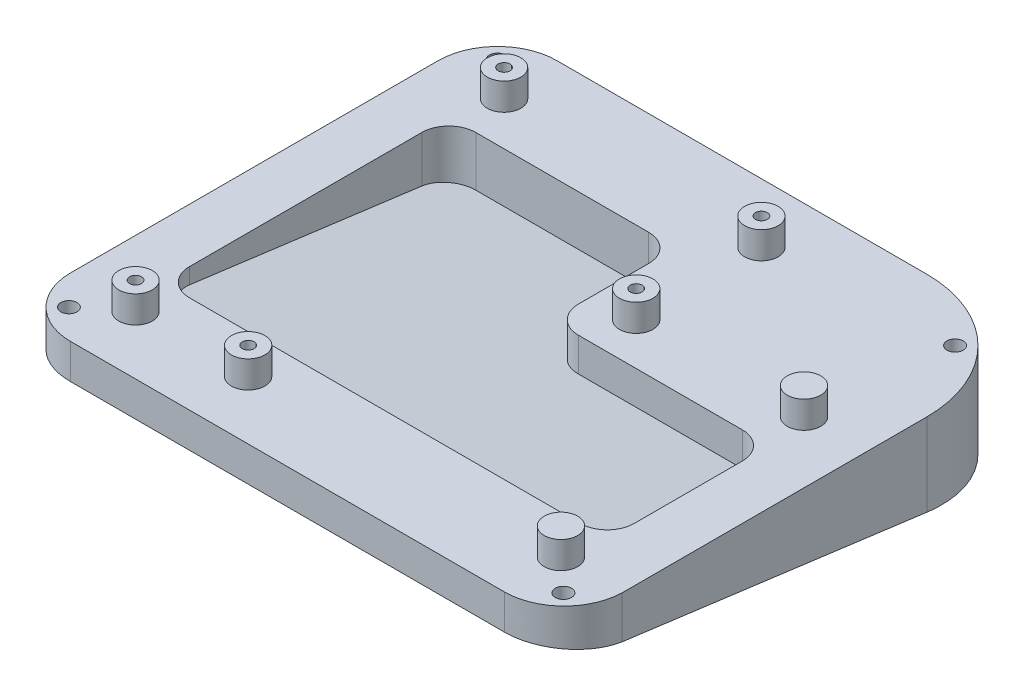
from build123d import *

# Parameters (mm, degrees)
SKETCH1_R                        = 1.1
SKETCH1_R_2                      = 1.5
BOSS_EXTRUDE1_DEPTH              = 3.048
SKETCH2_R                        = 3.1
SKETCH2_R_2                      = 1.1
BOSS_EXTRUDE2_DEPTH              = 5
BOSS_EXTRUDE4_START              = -13.75
SKETCH1_5_R                      = 1.1
SKETCH1_5_R_2                    = 1.5
BOSS_EXTRUDE4_DEPTH              = 13.75
CUT_EXTRUDE1_DEPTH               = 113.753315675
CUT_EXTRUDE2_REACH               = 77.409
CUT_EXTRUDE2_OFFSET_FROM_SURFACE = 5
FILLET1_R                        = 5
BOSS_EXTRUDE6_DEPTH              = 1.5


with BuildPart() as part:
    # Sketch1 → Boss-Extrude1 (new body)
    with BuildSketch(Plane(origin=(0, 0, 0), x_dir=(1, 0, 0), z_dir=(0, 1, 0))):
        with BuildLine():
            Line((-40.209744398, 44.711958299), (28.240255602, 44.711958299))
            ThreePointArc((28.240255602, 44.711958299), (44.41885963, 38.010560578), (51.120255602, 21.831955824))
            Line((51.120255602, 21.831955824), (51.120255602, -34.598189146))
            ThreePointArc((51.120255602, -34.598189146), (47.776738906, -42.160841434), (40.130306185, -45.308043388))
            Line((40.130306185, -45.308043388), (-40.209744398, -45.308043388))
            ThreePointArc((-40.209744398, -45.308043388), (-47.987919588, -42.086217385), (-51.209744398, -34.308041701))
            Line((-51.209744398, -34.308041701), (-51.209744398, 33.711958299))
            ThreePointArc((-51.209744398, 33.711958299), (-47.987918991, 41.490132892), (-40.209744398, 44.711958299))
        make_face()
        with Locations((-39.019744398, -34.478043388)):
            Circle(SKETCH1_R, mode=Mode.SUBTRACT)
        with Locations((-18.179744398, -34.478043388)):
            Circle(SKETCH1_R, mode=Mode.SUBTRACT)
        with Locations((-39.019744398, 33.731958299)):
            Circle(SKETCH1_R, mode=Mode.SUBTRACT)
        with Locations((8.610255602, 33.731915189)):
            Circle(SKETCH1_R, mode=Mode.SUBTRACT)
        with Locations((8.655, 10.511958299)):
            Circle(SKETCH1_R, mode=Mode.SUBTRACT)
        with Locations((-45.866598648, 39.368812549)):
            Circle(SKETCH1_R_2, mode=Mode.SUBTRACT)
        with Locations((42.297539172, 35.889240349)):
            Circle(SKETCH1_R_2, mode=Mode.SUBTRACT)
        with Locations((45.695011225, -40.000653974)):
            Circle(SKETCH1_R_2, mode=Mode.SUBTRACT)
        with Locations((-45.858259021, -39.973270185)):
            Circle(SKETCH1_R_2, mode=Mode.SUBTRACT)
    extrude(amount=BOSS_EXTRUDE1_DEPTH)

    # Sketch2 → Boss-Extrude2 (add)
    # profile 1 of 7: a face of its own
    with BuildSketch(Plane(origin=(0, 3.048, 0), x_dir=(1, 0, 0), z_dir=(0, 1, 0))):
        with Locations((-39.019744398, 33.731958299)):
            Circle(SKETCH2_R)
        with Locations((-39.019744398, 33.731958299)):
            Circle(SKETCH2_R_2, mode=Mode.SUBTRACT)
    # profile 2 of 7: a face of its own
    with BuildSketch(Plane(origin=(0, 3.048, 0), x_dir=(1, 0, 0), z_dir=(0, 1, 0))):
        with Locations((8.610255602, 33.731915189)):
            Circle(SKETCH2_R)
        with Locations((8.610255602, 33.731915189)):
            Circle(SKETCH2_R_2, mode=Mode.SUBTRACT)
    # profile 3 of 7: a face of its own
    with BuildSketch(Plane(origin=(0, 3.048, 0), x_dir=(1, 0, 0), z_dir=(0, 1, 0))):
        with Locations((8.655, 10.511958299)):
            Circle(SKETCH2_R)
        with Locations((8.655, 10.511958299)):
            Circle(SKETCH2_R_2, mode=Mode.SUBTRACT)
    # profile 4 of 7: a face of its own
    with BuildSketch(Plane(origin=(0, 3.048, 0), x_dir=(1, 0, 0), z_dir=(0, 1, 0))):
        with Locations((-18.179744398, -34.478043388)):
            Circle(SKETCH2_R)
        with Locations((-18.179744398, -34.478043388)):
            Circle(SKETCH2_R_2, mode=Mode.SUBTRACT)
    # profile 5 of 7: a face of its own
    with BuildSketch(Plane(origin=(0, 3.048, 0), x_dir=(1, 0, 0), z_dir=(0, 1, 0))):
        with Locations((-39.019744398, -34.478043388)):
            Circle(SKETCH2_R)
        with Locations((-39.019744398, -34.478043388)):
            Circle(SKETCH2_R_2, mode=Mode.SUBTRACT)
    # profile 6 of 7: a face of its own
    with BuildSketch(Plane(origin=(0, 3.048, 0), x_dir=(1, 0, 0), z_dir=(0, 1, 0))):
        with Locations((39.720255602, -34.478043388)):
            Circle(SKETCH2_R)
    # profile 7 of 7: a face of its own
    with BuildSketch(Plane(origin=(0, 3.048, 0), x_dir=(1, 0, 0), z_dir=(0, 1, 0))):
        with Locations((39.720255602, 10.511958299)):
            Circle(SKETCH2_R)
    extrude(amount=BOSS_EXTRUDE2_DEPTH)

    # Sketch1<5> → Boss-Extrude4 (add)
    with BuildSketch(Plane(origin=(0, 0, 0), x_dir=(1, 0, 0), z_dir=(0, 1, 0)).offset(BOSS_EXTRUDE4_START)):
        with BuildLine():
            Line((-40.209744398, 44.711958299), (28.240255602, 44.711958299))
            ThreePointArc((28.240255602, 44.711958299), (44.41885963, 38.010560578), (51.120255602, 21.831955824))
            Line((51.120255602, 21.831955824), (51.120255602, -34.598189146))
            ThreePointArc((51.120255602, -34.598189146), (47.776738906, -42.160841434), (40.130306185, -45.308043388))
            Line((40.130306185, -45.308043388), (-40.209744398, -45.308043388))
            ThreePointArc((-40.209744398, -45.308043388), (-47.987919588, -42.086217385), (-51.209744398, -34.308041701))
            Line((-51.209744398, -34.308041701), (-51.209744398, 33.711958299))
            ThreePointArc((-51.209744398, 33.711958299), (-47.987918991, 41.490132892), (-40.209744398, 44.711958299))
        make_face()
        with Locations((-39.019744398, -34.478043388)):
            Circle(SKETCH1_5_R, mode=Mode.SUBTRACT)
        with Locations((-18.179744398, -34.478043388)):
            Circle(SKETCH1_5_R, mode=Mode.SUBTRACT)
        with Locations((-39.019744398, 33.731958299)):
            Circle(SKETCH1_5_R, mode=Mode.SUBTRACT)
        with Locations((8.610255602, 33.731915189)):
            Circle(SKETCH1_5_R, mode=Mode.SUBTRACT)
        with Locations((8.655, 10.511958299)):
            Circle(SKETCH1_5_R, mode=Mode.SUBTRACT)
        with Locations((-45.866598648, 39.368812549)):
            Circle(SKETCH1_5_R_2, mode=Mode.SUBTRACT)
        with Locations((42.297539172, 35.889240349)):
            Circle(SKETCH1_5_R_2, mode=Mode.SUBTRACT)
        with Locations((45.695011225, -40.000653974)):
            Circle(SKETCH1_5_R_2, mode=Mode.SUBTRACT)
        with Locations((-45.858259021, -39.973270185)):
            Circle(SKETCH1_5_R_2, mode=Mode.SUBTRACT)
    extrude(amount=BOSS_EXTRUDE4_DEPTH)

    # Sketch3 → Cut-Extrude1 (cut, through all)
    with BuildSketch(Plane.ZY.offset(51.209744398)):
        Polygon((-44.711958299, -13.75), (-33.711958299, -13.75), (34.308041701, -13.75), (45.308043388, -13.75), (45.308043388, -1.898641945), align=None)
    extrude(amount=-CUT_EXTRUDE1_DEPTH, mode=Mode.SUBTRACT)

    # Cut-Extrude2: up to this face of the body (flat: up to its plane, moved by the offset)
    cut_extrude2_end = Plane(part.part.faces().sort_by_distance((-0.446052123, -7.774765631, 0.674452735))[0]).offset(-CUT_EXTRUDE2_OFFSET_FROM_SURFACE)
    # Sketch4 → Cut-Extrude2 (cut, up to the picked face)
    with BuildSketch(Plane(origin=(0, 3.048, 0), x_dir=(1, 0, 0), z_dir=(0, 1, 0)), mode=Mode.PRIVATE) as cut_extrude2_sk1:
        Polygon((0.790255602, 2.691956612), (41.120255602, 2.691956612), (41.120255602, -27.308043388), (-41.209744398, -27.308043388), (-41.209744398, 2.691956612), (-41.209744398, 25.691956612), (0.790255602, 25.691956612), align=None)
    cut_extrude2_tool1 = split(extrude(cut_extrude2_sk1.sketch, amount=-CUT_EXTRUDE2_REACH, mode=Mode.PRIVATE), bisect_by=cut_extrude2_end, keep=Keep.BOTH, mode=Mode.PRIVATE)
    add(cut_extrude2_tool1.solids().sort_by(Axis((-5.714115, 3.048, 4.857594), (0, -1, 0)))[0], mode=Mode.SUBTRACT)

    # Fillet1
    fillet1_edges = [part.edges().sort_by_distance(p)[0] for p in [
        (41.120255602, 1.911378951, 27.308043388),
        (-41.209744398, 1.911378951, 27.308043388),
        (-41.209744398, -1.577412235, -25.691956612),
        (0.790255602, -1.577412235, -25.691956612),
        (41.120255602, -0.063408513, -2.691956612),
        (0.790255602, -0.063408513, -2.691956612),
    ]]
    fillet(fillet1_edges, radius=FILLET1_R)

    # Sketch5 → Boss-Extrude6 (add, along a direction that is not the sketch's normal)
    with BuildSketch(Plane(origin=(0, -7.72958688, 1.017619418), x_dir=(1, 0, 0), z_dir=(0, -0.9914448613738103, 0.13052619222005257))):
        with BuildLine():
            Line((-51.209744398, 33.577685726), (-51.209744398, -35.029257874))
            add(Edge.make_bspline(
                [(-51.209744398, -35.029257874), (-51.209744398, -46.124176441), (-40.209744398, -46.124176441)],
                knots=[4.71238898, 4.71238898, 4.71238898, 6.283185307, 6.283185307, 6.283185307], degree=2, weights=[1, 0.707106781, 1]))
            Line((-40.209744398, -46.124176441), (28.240255602, -46.124176441))
            add(Edge.make_bspline(
                [(28.240255602, -46.124176441), (51.120255602, -46.124176441), (51.120255602, -23.046745823)],
                knots=[0, 0, 0, 1.570796327, 1.570796327, 1.570796327], degree=2, weights=[1, 0.707106781, 1]))
            Line((51.120255602, -23.046745823), (51.120255602, 33.87033514))
            add(Edge.make_bspline(
                [(51.120255602, 33.87033514), (50.756477038, 44.58229707), (40.130306185, 44.672604293)],
                knots=[1.605036011, 1.605036011, 1.605036011, 3.133166993, 3.133166993, 3.133166993], degree=2, weights=[1, 0.722029225, 1]))
            Line((40.130306185, 44.672604293), (-40.209744398, 44.672604293))
            add(Edge.make_bspline(
                [(-40.209744398, 44.672604293), (-51.209744398, 44.672604293), (-51.209744398, 33.577685726)],
                knots=[3.141592654, 3.141592654, 3.141592654, 4.71238898, 4.71238898, 4.71238898], degree=2, weights=[1, 0.707106781, 1]))
        make_face()
    extrude(amount=BOSS_EXTRUDE6_DEPTH, dir=(0, -1, 0))


solid = part.part
